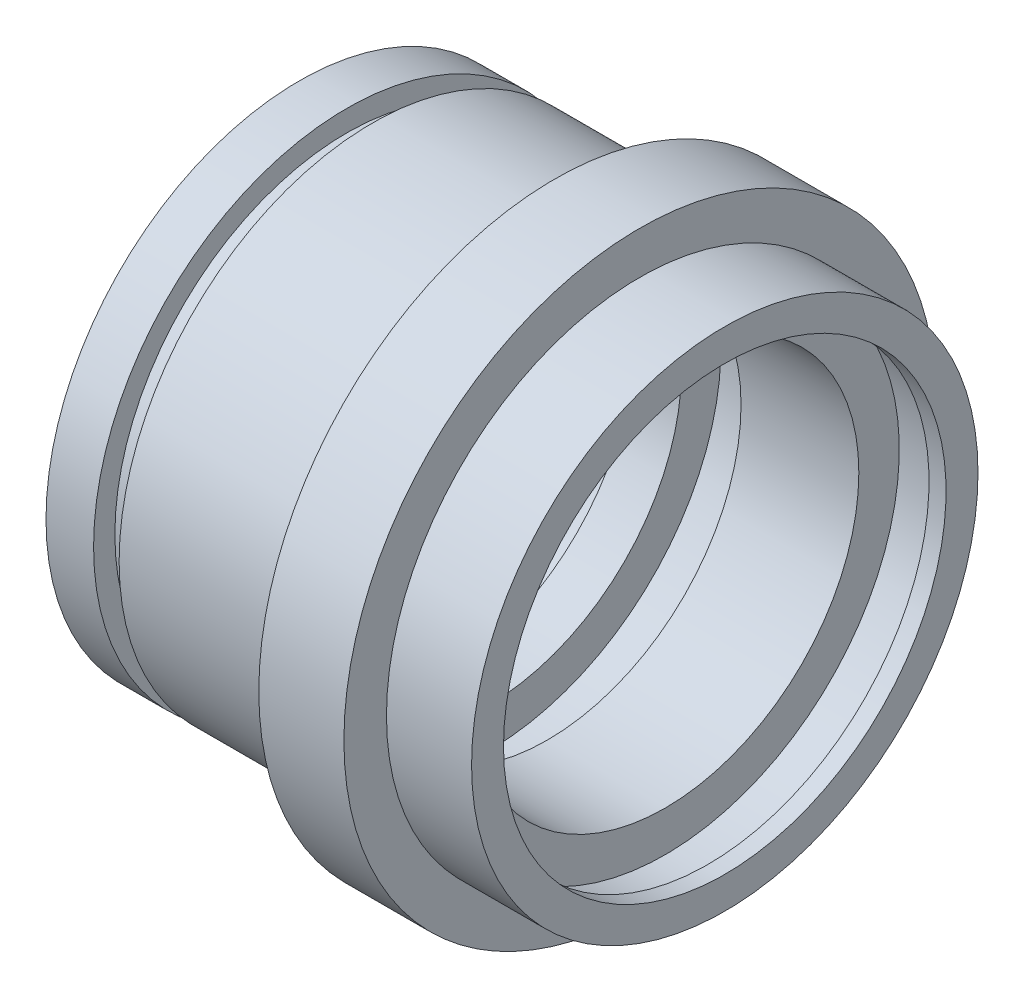
from build123d import *


with BuildPart() as part:
    # Sketch1 → Revolve1 (revolve)
    with BuildSketch(Plane.XY, mode=Mode.PRIVATE) as revolve1_sk:
        Polygon((-25, 22.75), (-15.49, 22.75), (-15.49, 24), (-8.49, 24), (-8.49, 22.75), (-2.84, 22.75), (-2.84, 27.39), (4.16, 27.39), (4.16, 22.75), (18, 22.75), (18, 27.5), (23, 27.5), (23, 26), (25, 26), (25, 29.75), (15, 29.75), (15, 34.75), (5, 34.75), (5, 29.75), (-16.41, 29.75), (-16.41, 27.25), (-19.41, 27.25), (-19.41, 29.75), (-25, 29.75), align=None)
    revolve(revolve1_sk.sketch.rotate(Axis((-25, 0, 0), (1, 0, 0)), 90), axis=Axis((-25, 0, 0), (1, 0, 0)))


solid = part.part
